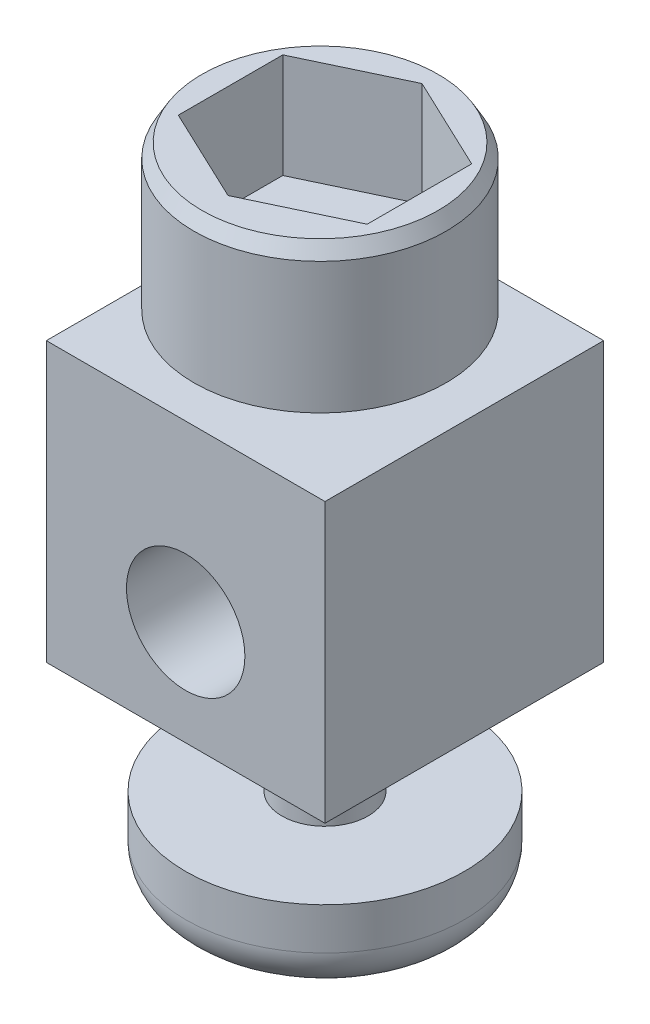
from build123d import *

# Parameters (mm, degrees)
SKETCH1_W          = 5.08
SKETCH1_H          = 5.08
EXTRUDE1_DEPTH     = 5.08
SKETCH2_R          = 1.0795
CUT_EXTRUDE1_DEPTH = 7.221703947
SKETCH3_R          = 0.7874
EXTRUDE2_DEPTH     = 4.0132
SKETCH4_R          = 1.3716
EXTRUDE3_DEPTH     = 3.175
SKETCH5_R          = 2.2987
EXTRUDE4_DEPTH     = 2.794
CHAMFER1_SIZE      = 0.254
CHAMFER1_SIZE2     = 0.146646968
CUT_EXTRUDE2_DEPTH = 1.905
CHAMFER2_SIZE      = 0.254
CHAMFER2_SIZE2     = 0.146646968


with BuildPart() as part:
    # Sketch1 → Extrude1 (new body)
    with BuildSketch(Plane.XY):
        Rectangle(SKETCH1_W, SKETCH1_H)
    extrude(amount=EXTRUDE1_DEPTH)

    # Sketch2 → Cut-Extrude1 (cut, through all)
    with BuildSketch(Plane.XY.offset(5.08)):
        with Locations((0, -0.635)):
            Circle(SKETCH2_R)
    extrude(amount=-CUT_EXTRUDE1_DEPTH, mode=Mode.SUBTRACT)

    # Sketch3 → Extrude2 (add)
    with BuildSketch(Plane.XZ.offset(2.54)):
        with Locations(Location((0, 2.54, 0), (0, 0, 180))):
            Circle(SKETCH3_R)
    extrude(amount=EXTRUDE2_DEPTH)

    # Sketch4 → Extrude3 (add)
    with BuildSketch(Plane(origin=(0, 2.54, 0), x_dir=(-1, 0, 0), z_dir=(0, 1, 0))):
        with Locations(Location((0, 2.630194731, 0), (0, 0, 270))):
            Circle(SKETCH4_R)
    extrude(amount=EXTRUDE3_DEPTH)

    # Sketch5 → Extrude4 (add)
    with BuildSketch(Plane(origin=(0, 5.715, 0), x_dir=(-1, 0, 0), z_dir=(0, 1, 0))):
        with Locations(Location((0, 2.630194731, 0), (0, 0, 90))):
            Circle(SKETCH5_R)
    extrude(amount=-EXTRUDE4_DEPTH)

    # Chamfer1
    chamfer1_edges = [part.edges().sort_by_distance(p)[0] for p in [
        (0, 5.715, 0.331494731),
    ]]
    chamfer1_side = [part.faces().sort_by_distance(p)[0] for p in [
        (0, 4.318, 0.331494731),
    ]]
    chamfer(chamfer1_edges, length=CHAMFER1_SIZE, length2=CHAMFER1_SIZE2, reference=chamfer1_side[0])

    # Sketch6 → Cut-Extrude2 (cut)
    with BuildSketch(Plane(origin=(0, 5.715, 0), x_dir=(-1, 0, 0), z_dir=(0, 1, 0))):
        Polygon((-1.721618465, 1.5875), (-1.721618465, 3.4925), (0, 4.308008959), (1.721756789, 3.49279208), (1.72148007, 1.5877921), (0, 0.771991041), align=None)
    extrude(amount=-CUT_EXTRUDE2_DEPTH, mode=Mode.SUBTRACT)

    # Chamfer2
    chamfer2_edges = [part.edges().sort_by_distance(p)[0] for p in [
        (0, 2.921, 0.331494731),
    ]]
    chamfer2_side = [part.faces().sort_by_distance(p)[0] for p in [
        (0, 2.921, 0.396511785),
    ]]
    chamfer(chamfer2_edges, length=CHAMFER2_SIZE, length2=CHAMFER2_SIZE2, reference=chamfer2_side[0])

    # Sketch9 → Revolve1 (revolve)
    with BuildSketch(Plane(origin=(0, 0, -0.758383952), x_dir=(0, 0, 1), z_dir=(-1, 0, 0)), mode=Mode.PRIVATE) as revolve1_sk:
        with BuildLine():
            Line((3.298383952, -4.571424559), (0.758383952, -4.571424559))
            Line((0.758383952, -4.571424559), (0.758383952, -5.333424559))
            ThreePointArc((0.758383952, -5.333424559), (0.981568584, -5.872239927), (1.520383952, -6.095424559))
            Line((1.520383952, -6.095424559), (3.298383952, -6.095424559))
            Line((3.298383952, -6.095424559), (3.298383952, -4.571424559))
        make_face()
    revolve(revolve1_sk.sketch.rotate(Axis((0, -4.571424559, 2.54), (0, -1, 0)), 270), axis=Axis((0, -4.571424559, 2.54), (0, -1, 0)))


solid = part.part
